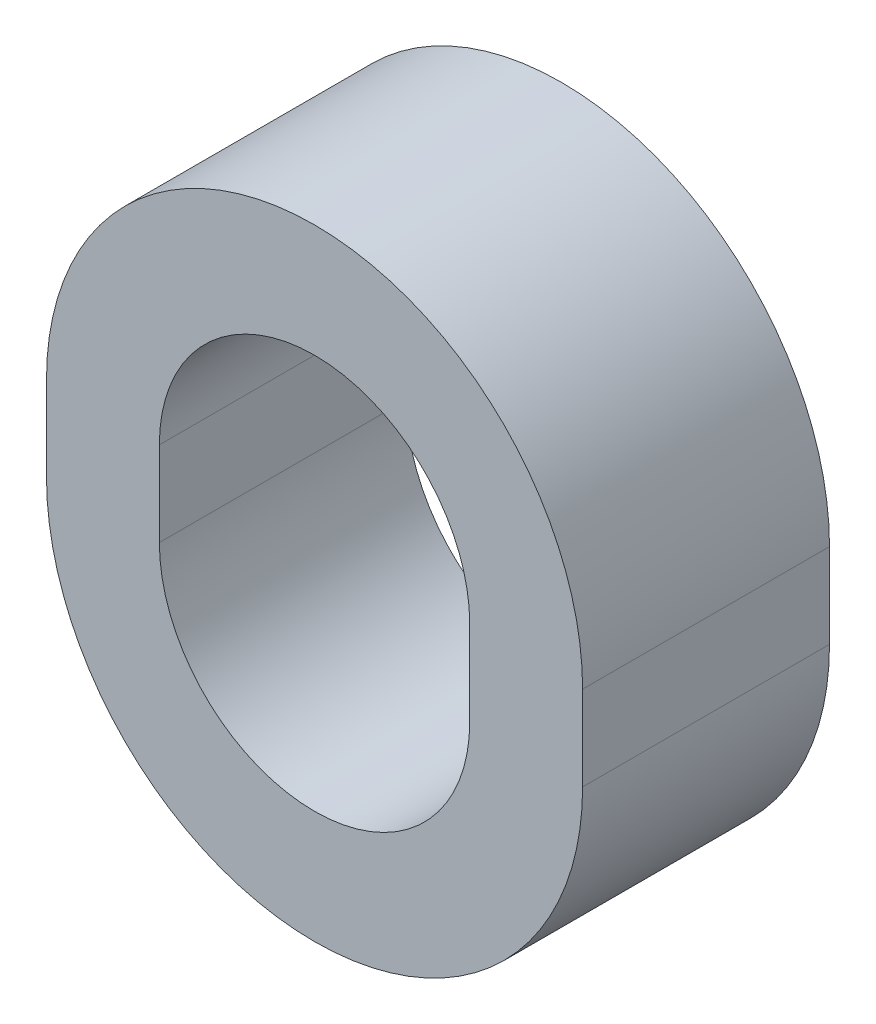
from build123d import *

# Parameters (mm, degrees)
EXTRUDE_1_DEPTH = 17.5


with BuildPart() as part:
    # Эскиз1 → Вытянуть1 (new body)
    with BuildSketch(Plane.XY):
        with BuildLine():
            Line((-19, -3), (-19, 3))
            ThreePointArc((-19, 3), (0, 22), (19, 3))
            Line((19, 3), (19, -3))
            ThreePointArc((19, -3), (0, -22), (-19, -3))
        make_face()
        with BuildLine():
            Line((-11, -3), (-11, 3))
            ThreePointArc((-11, 3), (0, 14), (11, 3))
            Line((11, 3), (11, -3))
            ThreePointArc((11, -3), (0, -14), (-11, -3))
        make_face(mode=Mode.SUBTRACT)
    extrude(amount=EXTRUDE_1_DEPTH)


solid = part.part
